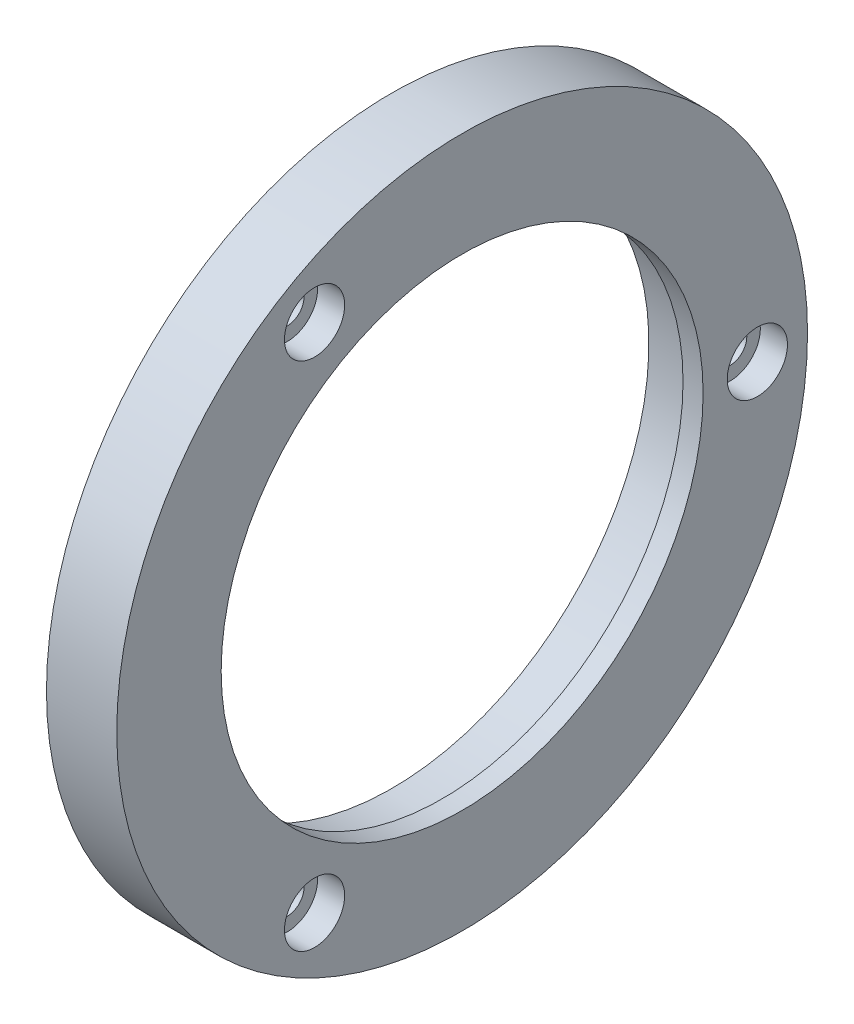
from build123d import *

# Parameters (mm, degrees)
AXIAL_HOLES_DEPTH      = 184.274684558
AXIAL_HOLES_DEPTH_BACK = 184.274684558
SKETCH2_R              = 1.65
CUT_EXTRUDE2_START     = 174
SKETCH3_R              = 3
CUT_EXTRUDE2_DEPTH     = 2.7


with BuildPart() as part:
    # Axial profile (mm) → Full revolution (revolve)
    with BuildSketch(Plane.XY, mode=Mode.PRIVATE) as full_revolution_sk:
        Polygon((169.7, 25.6), (174.7, 25.6), (174.7, 24), (176.7, 24), (176.7, 34.4), (169.7, 34.4), align=None)
    revolve(full_revolution_sk.sketch.rotate(Axis((-110, 0, 0), (1, 0, 0)), 90), axis=Axis((-110, 0, 0), (1, 0, 0)))

    # Sketch2 → Axial holes (cut, two sides: drawn at the far end of the back side and taken through both)
    with BuildSketch(Plane(origin=(0, 0, 0), x_dir=(0, 0, -1), z_dir=(1, 0, 0)).offset(-AXIAL_HOLES_DEPTH_BACK)):
        with Locations((29.4, 0)):
            Circle(SKETCH2_R)
        with Locations((-14.7, 25.461146871)):
            Circle(SKETCH2_R)
        with Locations((-14.7, -25.461146871)):
            Circle(SKETCH2_R)
    extrude(amount=AXIAL_HOLES_DEPTH + AXIAL_HOLES_DEPTH_BACK, mode=Mode.SUBTRACT)

    # Sketch3 → Cut-Extrude2 (cut)
    with BuildSketch(Plane(origin=(0, 0, 0), x_dir=(0, 0, -1), z_dir=(1, 0, 0)).offset(CUT_EXTRUDE2_START)):
        with Locations((29.4, 0)):
            Circle(SKETCH3_R)
        with Locations((-14.7, 25.461146871)):
            Circle(SKETCH3_R)
        with Locations((-14.7, -25.461146871)):
            Circle(SKETCH3_R)
    extrude(amount=CUT_EXTRUDE2_DEPTH, mode=Mode.SUBTRACT)


solid = part.part
